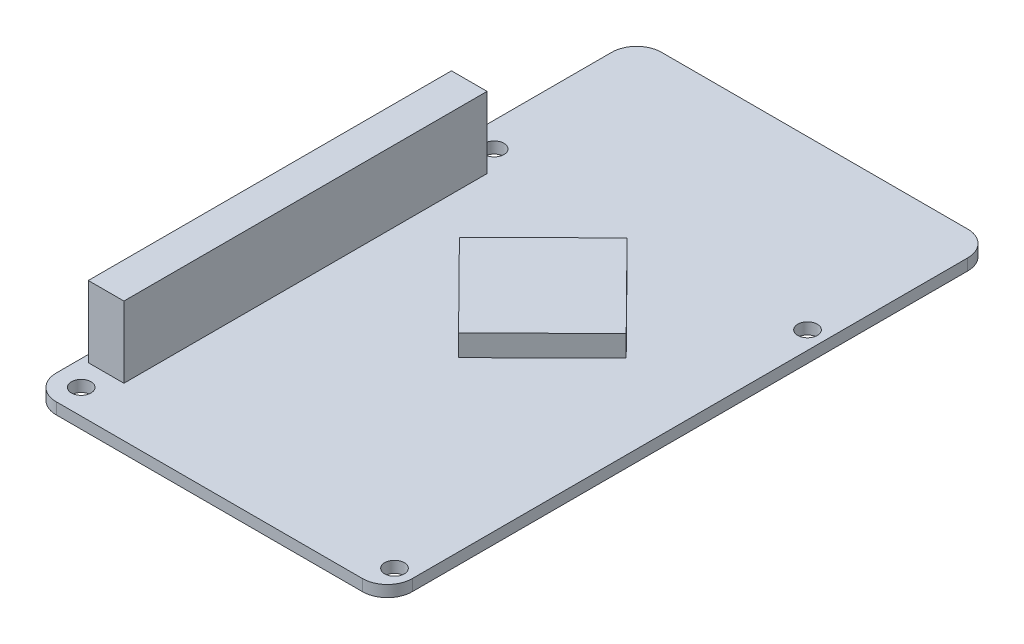
from build123d import *

# Parameters (mm, degrees)
SKETCH1_W           = 50
SKETCH1_H           = 85
SKETCH1_R           = 1.375
BOSS_EXTRUDE1_DEPTH = 1.6
FILLET1_R           = 3.5
SKETCH5_W           = 5
SKETCH5_H           = 51
BOSS_EXTRUDE3_DEPTH = 10
BOSS_EXTRUDE4_DEPTH = 3


with BuildPart() as part:
    # Sketch1 → Boss-Extrude1 (new body)
    with BuildSketch(Plane(origin=(0, 0, 0), x_dir=(1, 0, 0), z_dir=(0, 1, 0))):
        with Locations((25, 42.5)):
            Rectangle(SKETCH1_W, SKETCH1_H)
        with Locations(Location((3.5, 3.5, 0), (0, 0, 270))):
            Circle(SKETCH1_R, mode=Mode.SUBTRACT)
        with Locations(Location((47.5, 3.5, 0), (0, 0, 270))):
            Circle(SKETCH1_R, mode=Mode.SUBTRACT)
        with Locations(Location((47.5, 61.5, 0), (0, 0, 270))):
            Circle(SKETCH1_R, mode=Mode.SUBTRACT)
        with Locations(Location((3.5, 61.5, 0), (0, 0, 270))):
            Circle(SKETCH1_R, mode=Mode.SUBTRACT)
    extrude(amount=BOSS_EXTRUDE1_DEPTH)

    # Fillet1
    fillet1_edges = [part.edges().sort_by_distance(p)[0] for p in [
        (0, 0.8, -85),
        (50, 0.8, -85),
        (50, 0.8, 0),
        (0, 0.8, 0),
    ]]
    fillet(fillet1_edges, radius=FILLET1_R)

    # Sketch5 → Boss-Extrude3 (add)
    with BuildSketch(Plane(origin=(0, 1.6, 0), x_dir=(1, 0, 0), z_dir=(0, 1, 0))):
        with Locations((3.5, 32.5)):
            Rectangle(SKETCH5_W, SKETCH5_H)
    extrude(amount=BOSS_EXTRUDE3_DEPTH)

    # Sketch6 → Boss-Extrude4 (add)
    with BuildSketch(Plane(origin=(0, 1.6, 0), x_dir=(1, 0, 0), z_dir=(0, 1, 0))):
        Polygon((26.64840561, 57.006203003), (38.214146185, 45.322359626), (26.383805878, 33.611602944), (14.818065303, 45.295446321), align=None)
    extrude(amount=BOSS_EXTRUDE4_DEPTH)


solid = part.part
